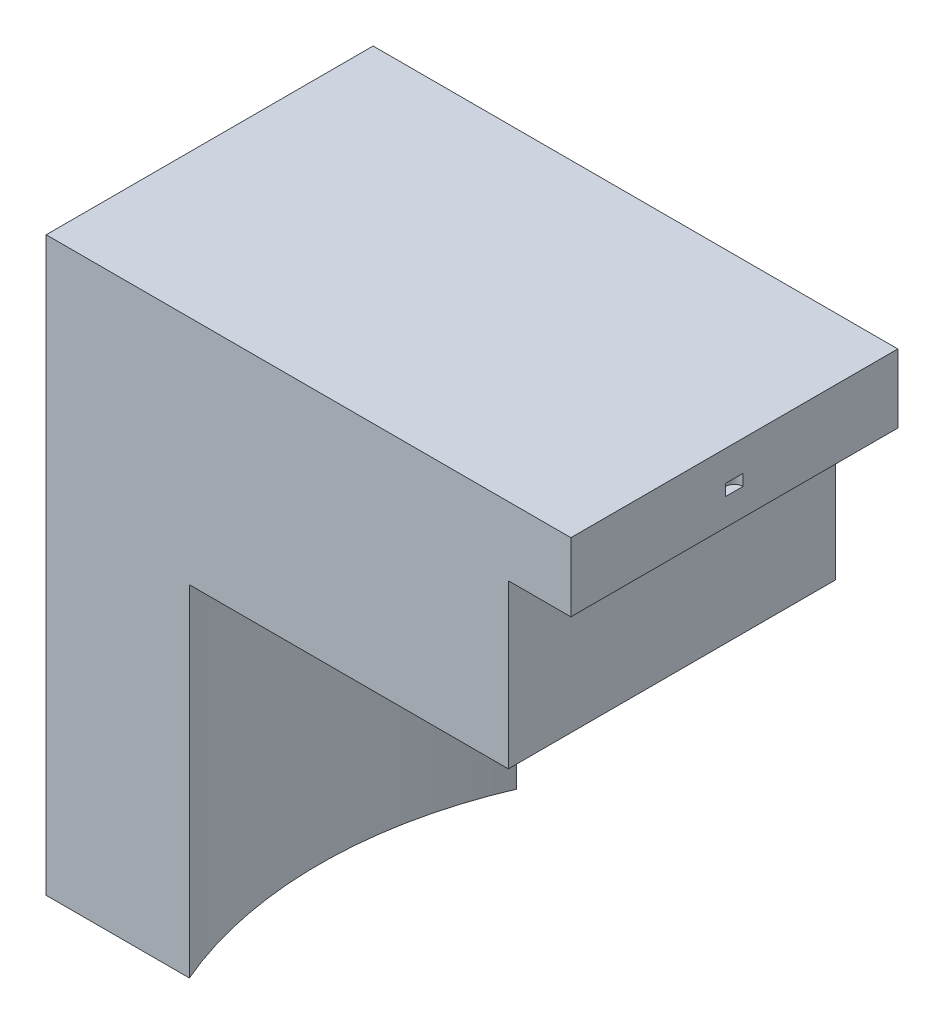
from build123d import *

# Parameters (mm, degrees)
BOSS_EXTRUDE1_DEPTH = 2.54
SKETCH4_W           = 0.135
SKETCH4_H           = 0.17696191
SKETCH4_W_2         = 6.45
SKETCH4_H_2         = 5.360645495


with BuildPart() as part:
    # Sketch2 → Boss-Extrude1 (new, symmetric)
    with BuildSketch(Plane.XY):
        Polygon((0, 3.166258563), (-8.153042882, 3.166258563), (-8.153042882, -5.723741437), (0, -5.723741437), (0, -0.430777301), (-0.971812772, -0.430777301), (-0.971812772, 2.100957578), (0, 2.100957578), align=None)
    extrude(amount=BOSS_EXTRUDE1_DEPTH, both=True)

    # Sketch4 → Cut-Revolve2 (revolve, cut)
    with BuildSketch(Plane.XY):
        with Locations((-0.0675, 2.60664071)):
            Rectangle(SKETCH4_W, SKETCH4_H)
        with Locations((-3.225, -3.111100048)):
            Rectangle(SKETCH4_W_2, SKETCH4_H_2)
    revolve(axis=Axis((0, 5.644041385, 0), (0, -1, 0)), mode=Mode.SUBTRACT)


solid = part.part
